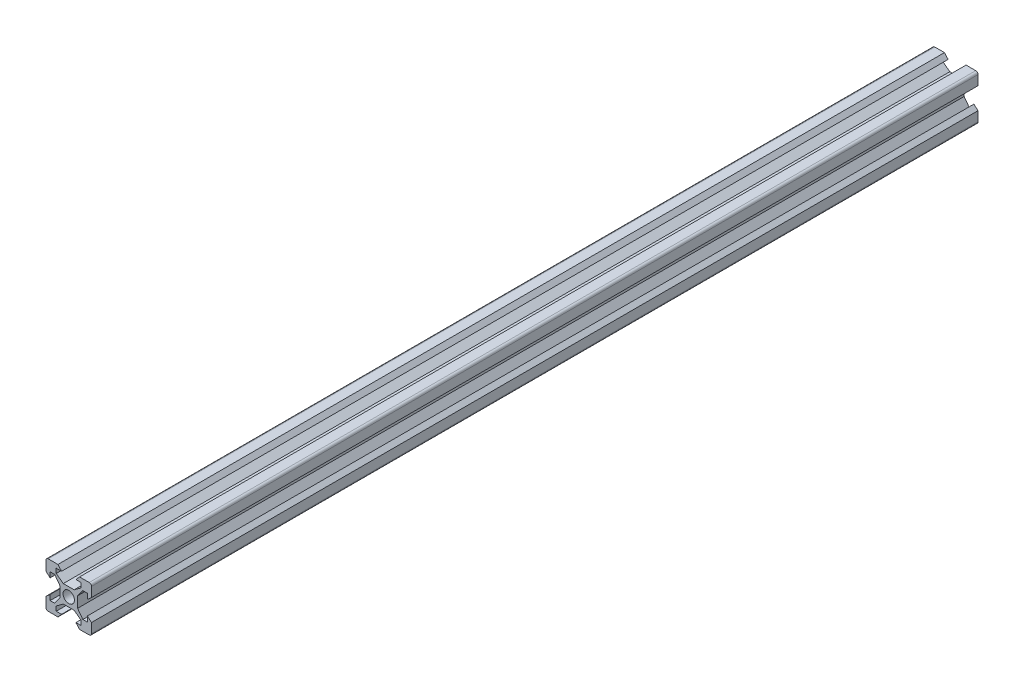
from build123d import *

# Parameters (mm, degrees)
SKETCH1_R           = 2.5
BOSS_EXTRUDE1_DEPTH = 390


with BuildPart() as part:
    # Sketch1 → Boss-Extrude1 (new body)
    with BuildSketch(Plane.XY):
        with BuildLine():
            Line((-5.5, 8.2), (-3.15, 8.2))
            Line((-3.15, 8.2), (-4.75, 10))
            Line((-4.75, 10), (-9, 10))
            ThreePointArc((-9, 10), (-9.707106781, 9.707106781), (-10, 9))
            Line((-10, 9), (-10, 4.75))
            Line((-10, 4.75), (-8.2, 3.15))
            Line((-8.2, 3.15), (-8.2, 5.5))
            Line((-8.2, 5.5), (-6.2, 5.5))
            Line((-6.2, 5.5), (-3.9, 2.387933369))
            Line((-3.9, 2.387933369), (-3.9, -2.387933369))
            Line((-3.9, -2.387933369), (-6.2, -5.5))
            Line((-6.2, -5.5), (-8.2, -5.5))
            Line((-8.2, -5.5), (-8.2, -3.15))
            Line((-8.2, -3.15), (-10, -4.75))
            Line((-10, -4.75), (-10, -9))
            ThreePointArc((-10, -9), (-9.707106781, -9.707106781), (-9, -10))
            Line((-9, -10), (-4.75, -10))
            Line((-4.75, -10), (-3.15, -8.2))
            Line((-3.15, -8.2), (-5.5, -8.2))
            Line((-5.5, -8.2), (-5.5, -6.2))
            Line((-5.5, -6.2), (-2.387933369, -3.9))
            Line((-2.387933369, -3.9), (2.387933369, -3.9))
            Line((2.387933369, -3.9), (5.5, -6.2))
            Line((5.5, -6.2), (5.5, -8.2))
            Line((5.5, -8.2), (3.15, -8.2))
            Line((3.15, -8.2), (4.75, -10))
            Line((4.75, -10), (9, -10))
            ThreePointArc((9, -10), (9.707106781, -9.707106781), (10, -9))
            Line((10, -9), (10, -4.75))
            Line((10, -4.75), (8.2, -3.15))
            Line((8.2, -3.15), (8.2, -5.5))
            Line((8.2, -5.5), (6.2, -5.5))
            Line((6.2, -5.5), (3.9, -2.387933369))
            Line((3.9, -2.387933369), (3.9, 2.387933369))
            Line((3.9, 2.387933369), (6.2, 5.5))
            Line((6.2, 5.5), (8.2, 5.5))
            Line((8.2, 5.5), (8.2, 3.15))
            Line((8.2, 3.15), (10, 4.75))
            Line((10, 4.75), (10, 9))
            ThreePointArc((10, 9), (9.707106781, 9.707106781), (9, 10))
            Line((9, 10), (4.75, 10))
            Line((4.75, 10), (3.15, 8.2))
            Line((3.15, 8.2), (5.5, 8.2))
            Line((5.5, 8.2), (5.5, 6.2))
            Line((5.5, 6.2), (2.387933369, 3.9))
            Line((2.387933369, 3.9), (-2.387933369, 3.9))
            Line((-2.387933369, 3.9), (-5.5, 6.2))
            Line((-5.5, 6.2), (-5.5, 8.2))
        make_face()
        Circle(SKETCH1_R, mode=Mode.SUBTRACT)
    extrude(amount=BOSS_EXTRUDE1_DEPTH)


solid = part.part
